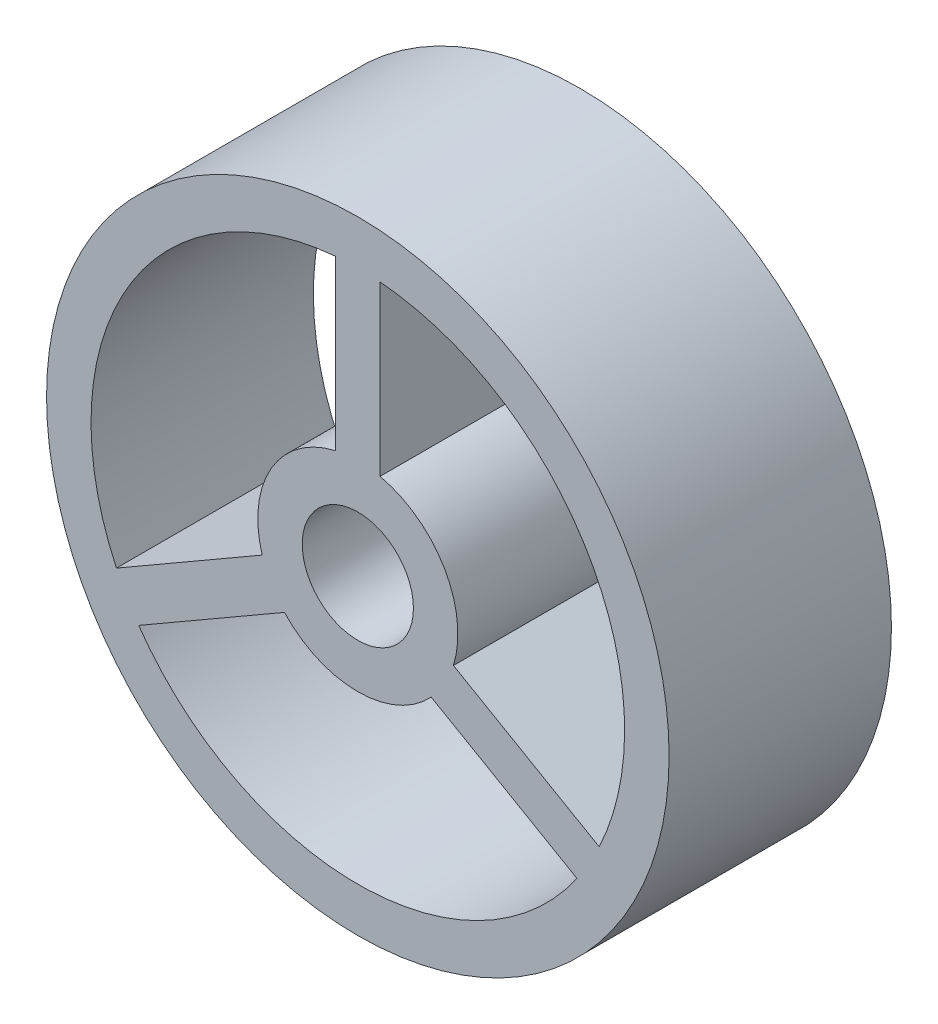
from build123d import *

# Parameters (mm, degrees)
SKETCH8_R           = 14
BOSS_EXTRUDE6_DEPTH = 10
SKETCH9_R           = 2.5
CUT_EXTRUDE1_DEPTH  = 10
CUT_EXTRUDE2_DEPTH  = 10


with BuildPart() as part:
    # Sketch8 → Boss-Extrude6 (new body)
    with BuildSketch(Plane.XY):
        Circle(SKETCH8_R)
    extrude(amount=BOSS_EXTRUDE6_DEPTH)

    # Sketch9 → Cut-Extrude1 (cut)
    with BuildSketch(Plane.XY.offset(10)):
        Circle(SKETCH9_R)
    extrude(amount=-CUT_EXTRUDE1_DEPTH, mode=Mode.SUBTRACT)

    # Sketch10 → Cut-Extrude2 (cut)
    with BuildSketch(Plane.XY.offset(10)):
        with BuildLine():
            ThreePointArc((-4.299671038, -1.327715693), (-3.897114317, 2.25), (-1, 4.387482194))
            Line((-1, 4.387482194), (-1, 11.958260743))
            ThreePointArc((-1, 11.958260743), (-10.392304845, 6), (-10.856157589, -5.113104968))
            Line((-10.856157589, -5.113104968), (-4.299671038, -1.327715693))
        make_face()
        with BuildLine():
            Line((1, 11.958260743), (1, 4.387482194))
            ThreePointArc((1, 4.387482194), (3.51781182, 2.80624304), (4.5, 0))
            ThreePointArc((4.5, 0), (4.449635922, -0.671371852), (4.299671038, -1.327715693))
            Line((4.299671038, -1.327715693), (10.856157589, -5.113104968))
            ThreePointArc((10.856157589, -5.113104968), (11.710548473, -2.619743207), (12, 0))
            ThreePointArc((12, 0), (8.831760866, 8.124038405), (1, 11.958260743))
        make_face()
        with BuildLine():
            ThreePointArc((3.299671038, -3.059766501), (0, -4.5), (-3.299671038, -3.059766501))
            Line((-3.299671038, -3.059766501), (-9.856157589, -6.845155775))
            ThreePointArc((-9.856157589, -6.845155775), (0, -12), (9.856157589, -6.845155775))
            Line((9.856157589, -6.845155775), (3.299671038, -3.059766501))
        make_face()
    extrude(amount=-CUT_EXTRUDE2_DEPTH, mode=Mode.SUBTRACT)


solid = part.part
